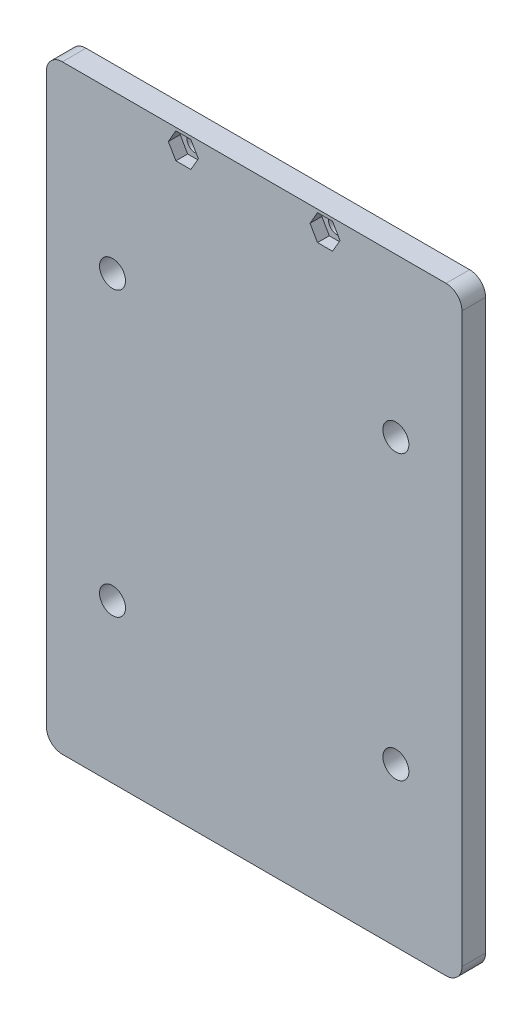
from build123d import *

# Parameters (mm, degrees)
SKETCH1_R           = 2.75
SKETCH1_R_2         = 1.75
BOSS_EXTRUDE1_DEPTH = 5
CUT_EXTRUDE1_DEPTH  = 2.5


with BuildPart() as part:
    # Sketch1 → Boss-Extrude1 (new body)
    with BuildSketch(Plane.XY):
        with BuildLine():
            Line((445.881443411, -1323.745162979), (445.881443411, -1203.505162979))
            ThreePointArc((445.881443411, -1203.505162979), (444.891464332, -1201.115142059), (442.501443411, -1200.125162979))
            Line((442.501443411, -1200.125162979), (361.261443411, -1200.125162979))
            ThreePointArc((361.261443411, -1200.125162979), (358.871422491, -1201.115142059), (357.881443411, -1203.505162979))
            Line((357.881443411, -1203.505162979), (357.881443411, -1323.745162979))
            ThreePointArc((357.881443411, -1323.745162979), (358.871422491, -1326.1351839), (361.261443411, -1327.125162979))
            Line((361.261443411, -1327.125162979), (442.501443411, -1327.125162979))
            ThreePointArc((442.501443411, -1327.125162979), (444.891464332, -1326.1351839), (445.881443411, -1323.745162979))
        make_face()
        with Locations((371.881443411, -1233.625162979)):
            Circle(SKETCH1_R, mode=Mode.SUBTRACT)
        with Locations((431.881443411, -1233.625162979)):
            Circle(SKETCH1_R, mode=Mode.SUBTRACT)
        with Locations((371.881443411, -1293.625162979)):
            Circle(SKETCH1_R, mode=Mode.SUBTRACT)
        with Locations((431.881443411, -1293.625162979)):
            Circle(SKETCH1_R, mode=Mode.SUBTRACT)
        with Locations((386.881443411, -1203.515162979)):
            Circle(SKETCH1_R_2, mode=Mode.SUBTRACT)
        with Locations((416.881443411, -1203.515162979)):
            Circle(SKETCH1_R_2, mode=Mode.SUBTRACT)
    extrude(amount=BOSS_EXTRUDE1_DEPTH)

    # Sketch2 → Cut-Extrude1 (cut)
    with BuildSketch(Plane.XY.offset(5)):
        Polygon((388.469156651, -1200.765162979), (385.293730171, -1200.765162979), (383.706016931, -1203.515162979), (385.293730171, -1206.265162979), (388.469156651, -1206.265162979), (390.056869892, -1203.515162979), align=None)
        Polygon((418.469156651, -1200.765162979), (415.293730171, -1200.765162979), (413.706016931, -1203.515162979), (415.293730171, -1206.265162979), (418.469156651, -1206.265162979), (420.056869892, -1203.515162979), align=None)
    extrude(amount=-CUT_EXTRUDE1_DEPTH, mode=Mode.SUBTRACT)


solid = part.part
